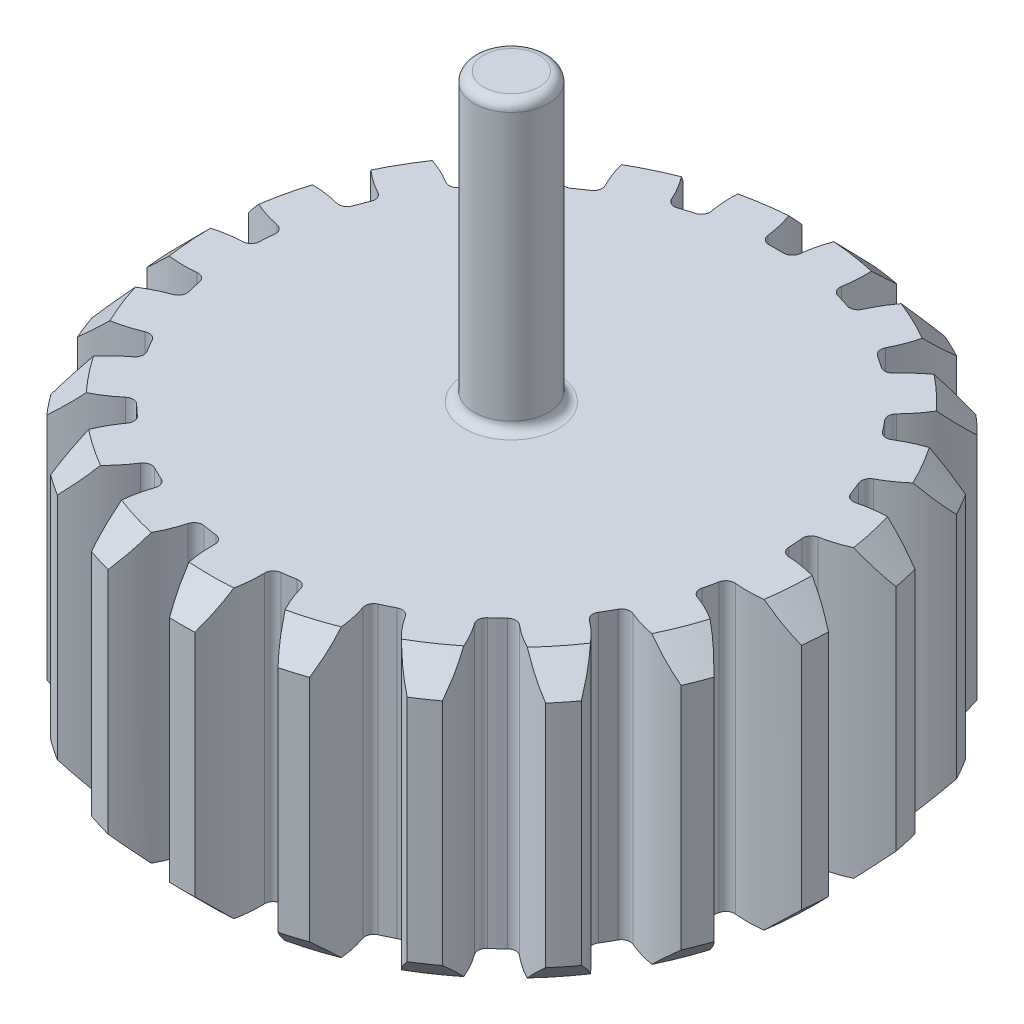
from build123d import *

# Parameters (mm, degrees)
ESQUISSE1_R                  = 17.25
BOSS_EXTRU_1_DEPTH           = 15
ENL_V_MAT_EXTRU_1_DEPTH      = 29.637824638
CONG_1_R                     = 0.45
CHANFREIN1_SIZE              = 1.5
R_P_TITION_CIRCULAIRE7_COUNT = 21
CONG_2_R                     = 0.45
ESQUISSE1_4_R                = 1.95
BOSS_EXTRU_2_DEPTH           = 30
CONG_4_R                     = 0.5
CONG_5_R                     = 0.5
ESQUISSE1_5_R                = 5
ENL_V_MAT_EXTRU_2_DEPTH      = 10


with BuildPart() as part:
    # Esquisse1 → Boss.-Extru.1 (new body)
    with BuildSketch(Plane(origin=(0, 0, 0), x_dir=(1, 0, 0), z_dir=(0, 1, 0))):
        with Locations(Location((0, 0, 0), (0, 0, 270))):
            Circle(ESQUISSE1_R)
    extrude(amount=BOSS_EXTRU_1_DEPTH)

    # Esquisse2 → Enlèv. mat.-Extru.1 (cut, symmetric)
    with BuildSketch(Plane(origin=(0, 0, 0), x_dir=(1, 0, 0), z_dir=(0, 1, 0))):
        with BuildLine():
            ThreePointArc((3.32328406, 13.471132397), (4.089728045, 13.25857268), (4.842732935, 13.00244449))
            ThreePointArc((4.842732935, 13.00244449), (5.670792884, 14.548760115), (6.881596704, 15.81790526))
            ThreePointArc((6.881596704, 15.81790526), (5.084526759, 16.4836309), (3.224701283, 16.945908109))
            ThreePointArc((3.224701283, 16.945908109), (3.510179431, 15.215221102), (3.32328406, 13.471132397))
        make_face()
    enl_v_mat_extru_1 = extrude(amount=ENL_V_MAT_EXTRU_1_DEPTH, both=True, mode=Mode.SUBTRACT)

    # Congé1
    cong_1_edges = [part.edges().sort_by_distance(p)[0] for p in [
        (4.842732935, 7.5, -13.00244449),
        (3.32328406, 7.5, -13.471132397),
    ]]
    fillet(cong_1_edges, radius=CONG_1_R)

    # Chanfrein1
    chanfrein1_edges = [part.edges().sort_by_distance(p)[0] for p in [
        (-17.173808763, 0, -1.619503801),
        (-17.173808763, 15, -1.619503801),
    ]]
    chamfer(chanfrein1_edges, length=CHANFREIN1_SIZE)

    # Répétition circulaire7: Enlèv. mat.-Extru.1 ×21 about axis
    r_p_tition_circulaire7_axis = Axis((0, 15, 0), (0, -1, 0))
    for i in range(1, R_P_TITION_CIRCULAIRE7_COUNT):
        add(enl_v_mat_extru_1.rotate(r_p_tition_circulaire7_axis, i * 360 / R_P_TITION_CIRCULAIRE7_COUNT), mode=Mode.SUBTRACT)

    # Congé2
    cong_2_edges = [part.edges().sort_by_distance(p)[0] for p in [
        (-7.146325853, 7.5, -11.893092609),
        (-8.460121692, 7.5, -10.997361773),
        (-10.334385233, 7.5, -9.25829935),
        (-11.32579151, 7.5, -8.0151152),
        (-12.604189133, 7.5, -5.800865565),
        (-13.18511505, 7.5, -4.320690469),
        (-13.754055516, 7.5, -1.827999418),
        (-13.872883255, 7.5, -0.242353428),
        (-13.681813707, 7.5, 2.307292499),
        (-13.327984904, 7.5, 3.857517778),
        (-12.393882709, 7.5, 6.237571353),
        (-11.598836604, 7.5, 7.614631601),
        (-10.004700843, 7.5, 9.613614619),
        (-8.839080772, 7.5, 10.695151991),
        (-6.726557402, 7.5, 12.135446037),
        (-5.293933824, 7.5, 12.825361191),
        (-2.850729817, 7.5, 13.578989819),
        (-1.278397623, 7.5, 13.815980766),
        (1.278397623, 7.5, 13.815980766),
        (2.850729817, 7.5, 13.578989819),
        (5.293933824, 7.5, 12.825361191),
        (6.726557402, 7.5, 12.135446037),
        (8.839080772, 7.5, 10.695151991),
        (10.004700843, 7.5, 9.613614619),
        (11.598836604, 7.5, 7.614631601),
        (12.393882709, 7.5, 6.237571353),
        (13.327984904, 7.5, 3.857517778),
        (13.681813707, 7.5, 2.307292499),
        (13.872883255, 7.5, -0.242353428),
        (13.754055516, 7.5, -1.827999418),
        (13.18511505, 7.5, -4.320690469),
        (12.604189133, 7.5, -5.800865565),
        (11.32579151, 7.5, -8.0151152),
        (10.334385233, 7.5, -9.25829935),
        (8.460121692, 7.5, -10.997361773),
        (7.146325853, 7.5, -11.893092609),
        (0.795046105, 7.5, -13.852202954),
        (-0.795046105, 7.5, -13.852202954),
        (-3.32328406, 7.5, -13.471132397),
        (-4.842732935, 7.5, -13.00244449),
    ]]
    fillet(cong_2_edges, radius=CONG_2_R)

    # Esquisse1<4> → Boss.-Extru.2 (add)
    with BuildSketch(Plane(origin=(0, 0, 0), x_dir=(1, 0, 0), z_dir=(0, 1, 0))):
        with Locations(Location((0, 0, 0), (0, 0, 270))):
            Circle(ESQUISSE1_4_R)
    extrude(amount=BOSS_EXTRU_2_DEPTH)

    # Congé4
    cong_4_edges = [part.edges().sort_by_distance(p)[0] for p in [
        (0, 30, -1.95),
    ]]
    fillet(cong_4_edges, radius=CONG_4_R)

    # Congé5
    cong_5_edges = [part.edges().sort_by_distance(p)[0] for p in [
        (0, 15, -1.95),
    ]]
    fillet(cong_5_edges, radius=CONG_5_R)

    # Esquisse1<5> → Enlèv. mat.-Extru.2 (cut)
    with BuildSketch(Plane(origin=(0, 0, 0), x_dir=(1, 0, 0), z_dir=(0, 1, 0))):
        with Locations(Location((0, 0, 0), (0, 0, 270))):
            Circle(ESQUISSE1_5_R)
    extrude(amount=ENL_V_MAT_EXTRU_2_DEPTH, mode=Mode.SUBTRACT)


solid = part.part
